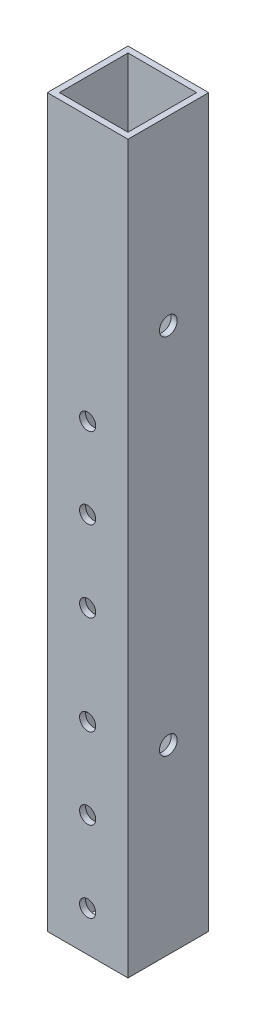
from build123d import *

# Parameters (mm, degrees)
SKETCH_1_W          = 20
SKETCH_1_H          = 20
SKETCH_1_W_2        = 17
SKETCH_1_H_2        = 17
EXTRUDE_1_DEPTH     = 180
SKETCH_2_R          = 2.2
CUT_EXTRUDE_1_DEPTH = 120
SKETCH_3_R          = 2
CUT_EXTRUDE_2_DEPTH = 3
SKETCH_4_R          = 2
CUT_EXTRUDE_3_DEPTH = 20


with BuildPart() as part:
    # 草图1 → 凸台-拉伸1 (new body)
    with BuildSketch(Plane(origin=(0, 0, 0), x_dir=(1, 0, 0), z_dir=(0, 1, 0))):
        Rectangle(SKETCH_1_W, SKETCH_1_H)
        Rectangle(SKETCH_1_W_2, SKETCH_1_H_2, mode=Mode.SUBTRACT)
    extrude(amount=EXTRUDE_1_DEPTH)

    # 草图2 → 切除-拉伸1 (cut)
    with BuildSketch(Plane(origin=(10, 0, 0), x_dir=(0, 0, -1), z_dir=(1, 0, 0))):
        with Locations((0, 135)):
            Circle(SKETCH_2_R)
        with Locations((0, 45)):
            Circle(SKETCH_2_R)
    extrude(amount=-CUT_EXTRUDE_1_DEPTH, mode=Mode.SUBTRACT)

    # 草图3 → 切除-拉伸2 (cut)
    with BuildSketch(Plane.XY.offset(10)):
        with Locations((0, 10)):
            Circle(SKETCH_3_R)
        with Locations((0, 30)):
            Circle(SKETCH_3_R)
        with Locations((0, 50)):
            Circle(SKETCH_3_R)
    extrude(amount=-CUT_EXTRUDE_2_DEPTH, mode=Mode.SUBTRACT)

    # 草图4 → 切除-拉伸3 (cut)
    with BuildSketch(Plane.XY.offset(10)):
        with Locations((0, 74.45)):
            Circle(SKETCH_4_R)
        with Locations((0, 94.45)):
            Circle(SKETCH_4_R)
        with Locations((0, 114.45)):
            Circle(SKETCH_4_R)
    extrude(amount=-CUT_EXTRUDE_3_DEPTH, mode=Mode.SUBTRACT)


solid = part.part
